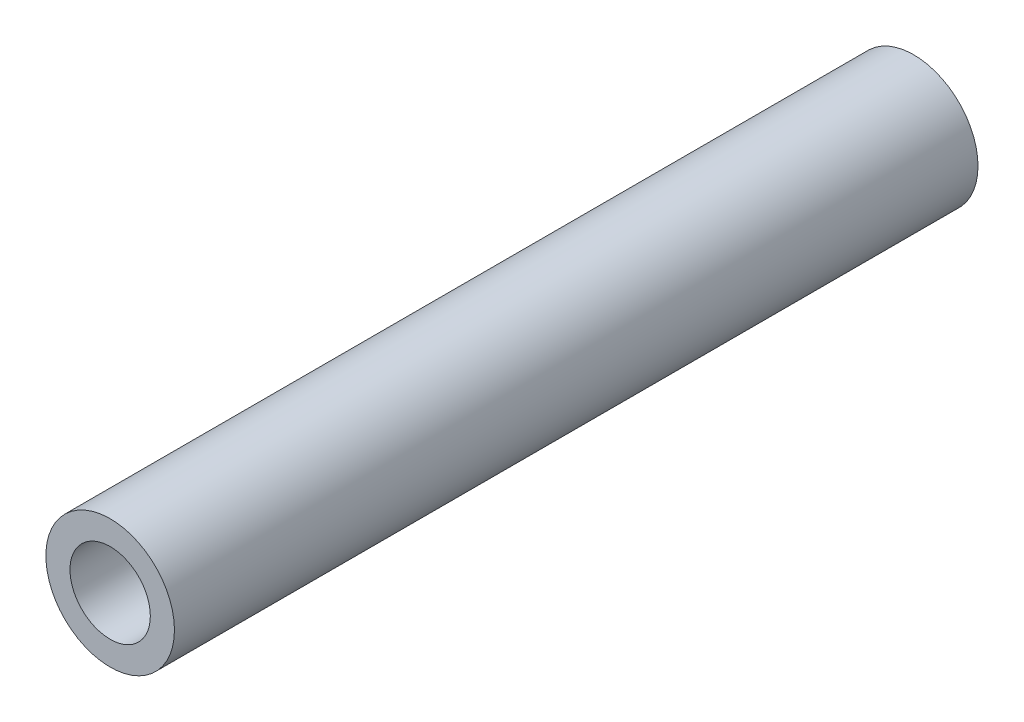
from build123d import *

# Parameters (mm, degrees)
SKETCH_1_R      = 2
SKETCH_1_R_2    = 1.25
EXTRUDE_1_DEPTH = 25


with BuildPart() as part:
    # 草图1 → 凸台-拉伸1 (new body)
    with BuildSketch(Plane.XY):
        Circle(SKETCH_1_R)
        Circle(SKETCH_1_R_2, mode=Mode.SUBTRACT)
    extrude(amount=EXTRUDE_1_DEPTH)


solid = part.part
